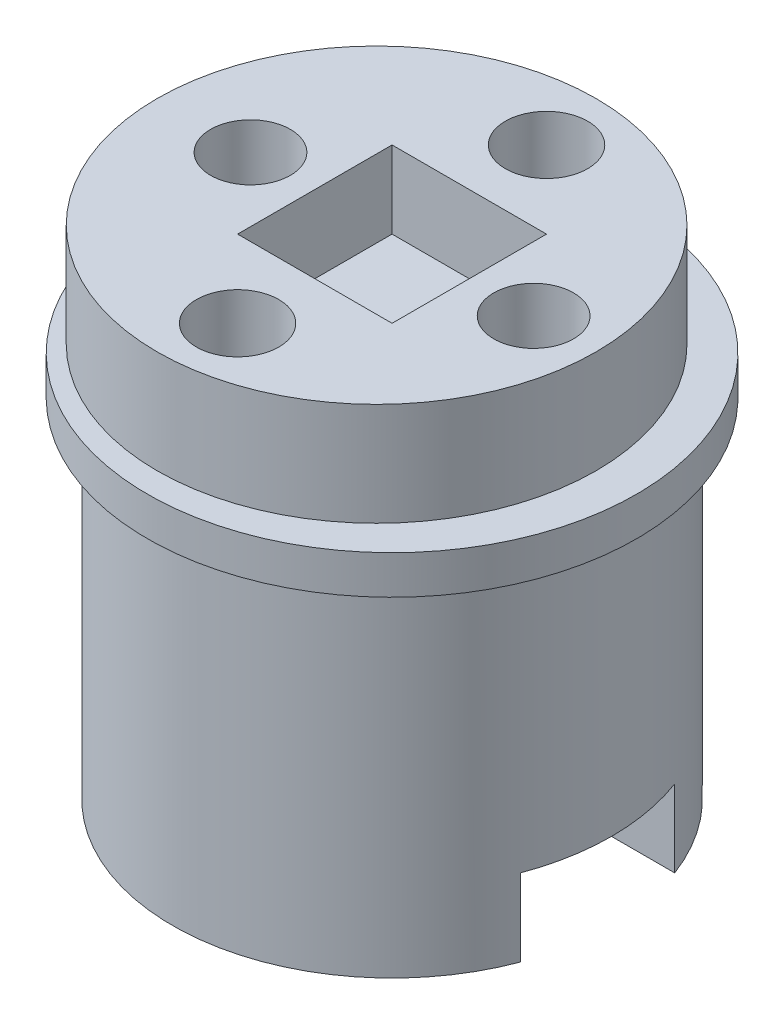
from build123d import *

# Parameters (mm, degrees)
SKETCH1_R            = 8.525
BOSS_EXTRUDE11_DEPTH = 4
SKETCH20_R           = 8.575
BOSS_EXTRUDE12_DEPTH = 4
SKETCH21_R           = 9.5
BOSS_EXTRUDE13_DEPTH = 1.25
SKETCH22_R           = 8.55
BOSS_EXTRUDE14_DEPTH = 7
SKETCH30_R           = 8.525
BOSS_EXTRUDE15_DEPTH = 15
SKETCH33_R           = 2.1
CUT_EXTRUDE14_DEPTH  = 5.8
BOSS_EXTRUDE16_START = 1.5
SKETCH35_R           = 9.5
BOSS_EXTRUDE16_DEPTH = 1.5
SKETCH36_R           = 1.6
CUT_EXTRUDE15_DEPTH  = 31.25
CIRPATTERN1_COUNT    = 2
SKETCH43_R           = 1.55
CUT_EXTRUDE20_DEPTH  = 31.25
SKETCH44_R           = 2
CUT_EXTRUDE21_DEPTH  = 4
CUT_EXTRUDE22_DEPTH  = 3
CUT_EXTRUDE23_DEPTH  = 3
SKETCH47_W           = 22.343806143
SKETCH47_H           = 21.789827479
CUT_EXTRUDE24_DEPTH  = 12.25
SKETCH48_W           = 6
SKETCH48_H           = 6
CUT_EXTRUDE25_DEPTH  = 3


with BuildPart() as part:
    # Sketch1 → Boss-Extrude11 (new body)
    with BuildSketch(Plane(origin=(0, 0, 0), x_dir=(1, 0, 0), z_dir=(0, 1, 0))):
        with Locations(Location((0, 0, 0), (0, 0, 270))):
            Circle(SKETCH1_R)
    extrude(amount=BOSS_EXTRUDE11_DEPTH)

    # Sketch20 → Boss-Extrude12 (add)
    with BuildSketch(Plane(origin=(0, 4, 0), x_dir=(1, 0, 0), z_dir=(0, 1, 0))):
        with Locations(Location((1.2, 0, 0), (0, 0, 96.402715722))):
            Circle(SKETCH20_R)
    extrude(amount=BOSS_EXTRUDE12_DEPTH)

    # Sketch21 → Boss-Extrude13 (add)
    with BuildSketch(Plane(origin=(0, 8, 0), x_dir=(1, 0, 0), z_dir=(0, 1, 0))):
        with Locations(Location((0.6, 0, 0), (0, 0, 270))):
            Circle(SKETCH21_R)
    extrude(amount=BOSS_EXTRUDE13_DEPTH)

    # Sketch22 → Boss-Extrude14 (add)
    with BuildSketch(Plane(origin=(0, 9.25, 0), x_dir=(1, 0, 0), z_dir=(0, 1, 0))):
        with Locations(Location((0.6, 0, 0), (0, 0, 270))):
            Circle(SKETCH22_R)
    extrude(amount=BOSS_EXTRUDE14_DEPTH)

    # Sketch30 → Boss-Extrude15 (add)
    with BuildSketch(Plane.XZ):
        with Locations(Location((0.6, 0, 0), (0, 0, 92.01669015))):
            Circle(SKETCH30_R)
    extrude(amount=BOSS_EXTRUDE15_DEPTH)

    # Sketch33 → Cut-Extrude14 (cut)
    with BuildSketch(Plane.XZ.offset(15)):
        with Locations(Location((0.6, 0, 0), (0, 0, 270))):
            Circle(SKETCH33_R)
    extrude(amount=-CUT_EXTRUDE14_DEPTH, mode=Mode.SUBTRACT)

    # Sketch35 → Boss-Extrude16 (add)
    with BuildSketch(Plane.XZ.offset(BOSS_EXTRUDE16_START)):
        with Locations(Location((0.6, 0, 0), (0, 0, 90))):
            Circle(SKETCH35_R)
    extrude(amount=-BOSS_EXTRUDE16_DEPTH)

    # Sketch36 → Cut-Extrude15 (cut)
    with BuildSketch(Plane.XZ.offset(15)):
        with Locations(Location((0.6, 6, 0), (0, 0, 270))):
            Circle(SKETCH36_R)
    cut_extrude15 = extrude(amount=-CUT_EXTRUDE15_DEPTH, mode=Mode.SUBTRACT)

    # CirPattern1: Cut-Extrude15 ×2 about axis
    cirpattern1_axis = Axis((0.6, 0, 0), (0, 1, 0))
    for i in range(1, CIRPATTERN1_COUNT):
        add(cut_extrude15.rotate(cirpattern1_axis, i * 360 / CIRPATTERN1_COUNT), mode=Mode.SUBTRACT)

    # Sketch43 → Cut-Extrude20 (cut)
    with BuildSketch(Plane.XZ.offset(15)):
        with Locations(Location((-4.9, 0, 0), (0, 0, 270))):
            Circle(SKETCH43_R)
        with Locations(Location((6.1, 0, 0), (0, 0, 270))):
            Circle(SKETCH43_R)
    extrude(amount=-CUT_EXTRUDE20_DEPTH, mode=Mode.SUBTRACT)

    # Sketch44 → Cut-Extrude21 (cut)
    with BuildSketch(Plane(origin=(0, 16.25, 0), x_dir=(1, 0, 0), z_dir=(0, 1, 0))):
        with Locations(Location((-4.9, 0, 0), (0, 0, 270))):
            Circle(SKETCH44_R)
        with Locations(Location((6.1, 0, 0), (0, 0, 270))):
            Circle(SKETCH44_R)
    extrude(amount=-CUT_EXTRUDE21_DEPTH, mode=Mode.SUBTRACT)

    # Sketch45 → Cut-Extrude22 (cut)
    with BuildSketch(Plane(origin=(0, 16.25, 0), x_dir=(1, 0, 0), z_dir=(0, 1, 0))):
        with BuildLine():
            Line((-2.4, -6), (-2.4, -10.872564071))
            Line((-2.4, -10.872564071), (3.6, -10.872564071))
            Line((3.6, -10.872564071), (3.6, -6))
            ThreePointArc((3.6, -6), (0.6, -3), (-2.4, -6))
        make_face()
        with BuildLine():
            Line((-2.4, 6), (-2.4, 11.42214608))
            Line((-2.4, 11.42214608), (3.6, 11.42214608))
            Line((3.6, 11.42214608), (3.6, 6))
            ThreePointArc((3.6, 6), (0.6, 3), (-2.4, 6))
        make_face()
    extrude(amount=-CUT_EXTRUDE22_DEPTH, mode=Mode.SUBTRACT)

    # Sketch46 → Cut-Extrude23 (cut)
    with BuildSketch(Plane.XZ.offset(15)):
        with BuildLine():
            Line((-4.9, 3), (-9.719928829, 3))
            Line((-9.719928829, 3), (-9.719928829, -3))
            Line((-9.719928829, -3), (-4.9, -3))
            ThreePointArc((-4.9, -3), (-1.9, 0), (-4.9, 3))
        make_face()
        with BuildLine():
            Line((6.1, 3), (10.889396495, 3))
            Line((10.889396495, 3), (10.889396495, -3))
            Line((10.889396495, -3), (6.1, -3))
            ThreePointArc((6.1, -3), (3.1, 0), (6.1, 3))
        make_face()
    extrude(amount=-CUT_EXTRUDE23_DEPTH, mode=Mode.SUBTRACT)

    # Sketch47 → Cut-Extrude24 (cut)
    with BuildSketch(Plane(origin=(0, 16.25, 0), x_dir=(1, 0, 0), z_dir=(0, 1, 0))):
        with Locations((0.37577054, -0.013189968)):
            Rectangle(SKETCH47_W, SKETCH47_H)
    extrude(amount=-CUT_EXTRUDE24_DEPTH, mode=Mode.SUBTRACT)

    # Sketch48 → Cut-Extrude25 (cut)
    with BuildSketch(Plane(origin=(0, 4, 0), x_dir=(1, 0, 0), z_dir=(0, 1, 0))):
        with Locations((0.6, 0)):
            Rectangle(SKETCH48_W, SKETCH48_H)
    extrude(amount=-CUT_EXTRUDE25_DEPTH, mode=Mode.SUBTRACT)


solid = part.part
